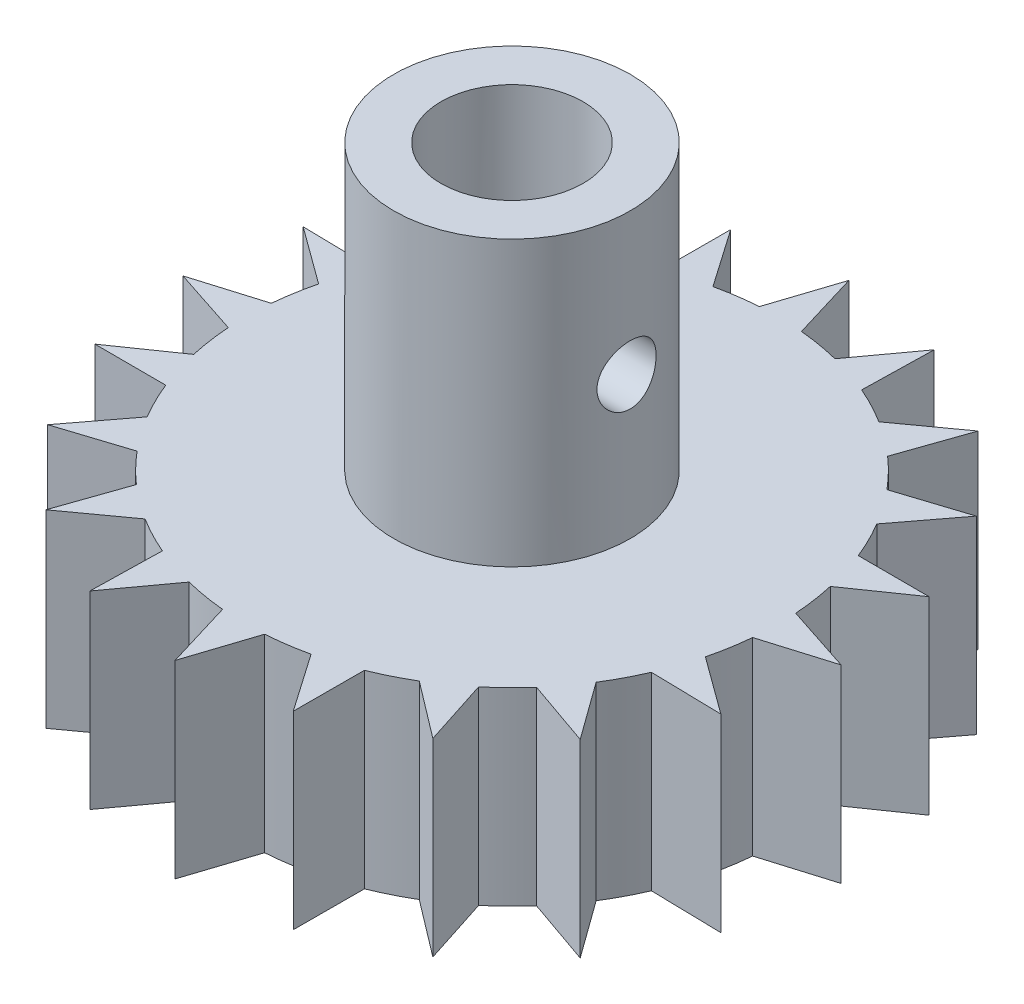
from build123d import *

# Parameters (mm, degrees)
SKETCH2_R               = 5
SKETCH2_R_2             = 3
BOSS_EXTRUDE1_DEPTH     = 20
CUT_EXTRUDE1_DEPTH      = 22.213203436
CUT_EXTRUDE1_DEPTH_BACK = 22.213203436
SKETCH3_R               = 1.25
BOSS_EXTRUDE2_DEPTH     = 8


with BuildPart() as part:
    # Sketch2 → Boss-Extrude1 (new body)
    with BuildSketch(Plane(origin=(0, 0, 0), x_dir=(1, 0, 0), z_dir=(0, 1, 0))):
        with Locations(Location((0, 0, 0), (0, 0, 270))):
            Circle(SKETCH2_R)
        with Locations(Location((0, 0, 0), (0, 0, 270))):
            Circle(SKETCH2_R_2, mode=Mode.SUBTRACT)
    extrude(amount=BOSS_EXTRUDE1_DEPTH)

    # Sketch3 → Cut-Extrude1 (cut, two sides: drawn at the far end of the back side and taken through both)
    with BuildSketch(Plane(origin=(0, 0, 0), x_dir=(0, 0, -1), z_dir=(1, 0, 0)).offset(-CUT_EXTRUDE1_DEPTH_BACK)):
        with Locations((0, 14)):
            Circle(SKETCH3_R)
    extrude(amount=CUT_EXTRUDE1_DEPTH + CUT_EXTRUDE1_DEPTH_BACK, mode=Mode.SUBTRACT)

    # Sketch4 → Boss-Extrude2 (add)
    with BuildSketch(Plane.XZ):
        with BuildLine():
            Line((11.223747146, -0.768114575), (14.074787242, 0.165464759))
            Line((14.074787242, 0.165464759), (11.202587609, 1.031761053))
            ThreePointArc((11.202587609, 1.031761053), (11.090038067, 1.890385058), (10.911778318, 2.737808237))
            Line((10.911778318, 2.737808237), (13.334786699, 4.506714787))
            Line((13.334786699, 4.506714787), (10.335462245, 4.443053024))
            ThreePointArc((10.335462245, 4.443053024), (9.963091861, 5.224873259), (9.531688601, 5.975735303))
            Line((9.531688601, 5.975735303), (11.289484326, 8.406816172))
            Line((11.289484326, 8.406816172), (8.456629826, 7.41942801))
            ThreePointArc((8.456629826, 7.41942801), (7.860888806, 8.047914461), (7.218570793, 8.628715763))
            Line((7.218570793, 8.628715763), (8.139088568, 11.483999816))
            Line((8.139088568, 11.483999816), (5.750003558, 9.669537687))
            ThreePointArc((5.750003558, 9.669537687), (4.989207185, 10.083169723), (4.19884898, 10.437057403))
            Line((4.19884898, 10.437057403), (4.191982112, 13.437049544))
            Line((4.191982112, 13.437049544), (2.48052688, 10.973125644))
            ThreePointArc((2.48052688, 10.973125644), (1.629147203, 11.131414079), (0.768114575, 11.223747146))
            Line((0.768114575, 11.223747146), (-0.165464759, 14.074787242))
            Line((-0.165464759, 14.074787242), (-1.031761053, 11.202587609))
            ThreePointArc((-1.031761053, 11.202587609), (-1.890385058, 11.090038067), (-2.737808237, 10.911778318))
            Line((-2.737808237, 10.911778318), (-4.506714787, 13.334786699))
            Line((-4.506714787, 13.334786699), (-4.443053024, 10.335462245))
            ThreePointArc((-4.443053024, 10.335462245), (-5.224873259, 9.963091861), (-5.975735303, 9.531688601))
            Line((-5.975735303, 9.531688601), (-8.406816172, 11.289484326))
            Line((-8.406816172, 11.289484326), (-7.41942801, 8.456629826))
            ThreePointArc((-7.41942801, 8.456629826), (-8.047914461, 7.860888806), (-8.628715763, 7.218570793))
            Line((-8.628715763, 7.218570793), (-11.483999816, 8.139088568))
            Line((-11.483999816, 8.139088568), (-9.669537687, 5.750003558))
            ThreePointArc((-9.669537687, 5.750003558), (-10.083169723, 4.989207185), (-10.437057403, 4.19884898))
            Line((-10.437057403, 4.19884898), (-13.437049544, 4.191982112))
            Line((-13.437049544, 4.191982112), (-10.973125644, 2.48052688))
            ThreePointArc((-10.973125644, 2.48052688), (-11.131414079, 1.629147203), (-11.223747146, 0.768114575))
            Line((-11.223747146, 0.768114575), (-14.074787242, -0.165464759))
            Line((-14.074787242, -0.165464759), (-11.202587609, -1.031761053))
            ThreePointArc((-11.202587609, -1.031761053), (-11.090038067, -1.890385058), (-10.911778318, -2.737808237))
            Line((-10.911778318, -2.737808237), (-13.334786699, -4.506714787))
            Line((-13.334786699, -4.506714787), (-10.335462245, -4.443053024))
            ThreePointArc((-10.335462245, -4.443053024), (-9.963091861, -5.224873259), (-9.531688601, -5.975735303))
            Line((-9.531688601, -5.975735303), (-11.289484326, -8.406816172))
            Line((-11.289484326, -8.406816172), (-8.456629826, -7.41942801))
            ThreePointArc((-8.456629826, -7.41942801), (-7.860888806, -8.047914461), (-7.218570793, -8.628715763))
            Line((-7.218570793, -8.628715763), (-8.139088568, -11.483999816))
            Line((-8.139088568, -11.483999816), (-5.750003558, -9.669537687))
            ThreePointArc((-5.750003558, -9.669537687), (-4.989207185, -10.083169723), (-4.19884898, -10.437057403))
            Line((-4.19884898, -10.437057403), (-4.191982112, -13.437049544))
            Line((-4.191982112, -13.437049544), (-2.48052688, -10.973125644))
            ThreePointArc((-2.48052688, -10.973125644), (-1.629147203, -11.131414079), (-0.768114575, -11.223747146))
            Line((-0.768114575, -11.223747146), (0.165464759, -14.074787242))
            Line((0.165464759, -14.074787242), (1.031761053, -11.202587609))
            ThreePointArc((1.031761053, -11.202587609), (1.890385058, -11.090038067), (2.737808237, -10.911778318))
            Line((2.737808237, -10.911778318), (4.506714787, -13.334786699))
            Line((4.506714787, -13.334786699), (4.443053024, -10.335462245))
            ThreePointArc((4.443053024, -10.335462245), (5.224873259, -9.963091861), (5.975735303, -9.531688601))
            Line((5.975735303, -9.531688601), (8.406816172, -11.289484326))
            Line((8.406816172, -11.289484326), (7.41942801, -8.456629826))
            ThreePointArc((7.41942801, -8.456629826), (8.047914461, -7.860888806), (8.628715763, -7.218570793))
            Line((8.628715763, -7.218570793), (11.483999816, -8.139088568))
            Line((11.483999816, -8.139088568), (9.669537687, -5.750003558))
            ThreePointArc((9.669537687, -5.750003558), (10.083169723, -4.989207185), (10.437057403, -4.19884898))
            Line((10.437057403, -4.19884898), (13.437049544, -4.191982112))
            Line((13.437049544, -4.191982112), (10.973125644, -2.48052688))
            ThreePointArc((10.973125644, -2.48052688), (11.131414079, -1.629147203), (11.223747146, -0.768114575))
        make_face()
    extrude(amount=-BOSS_EXTRUDE2_DEPTH)


solid = part.part
